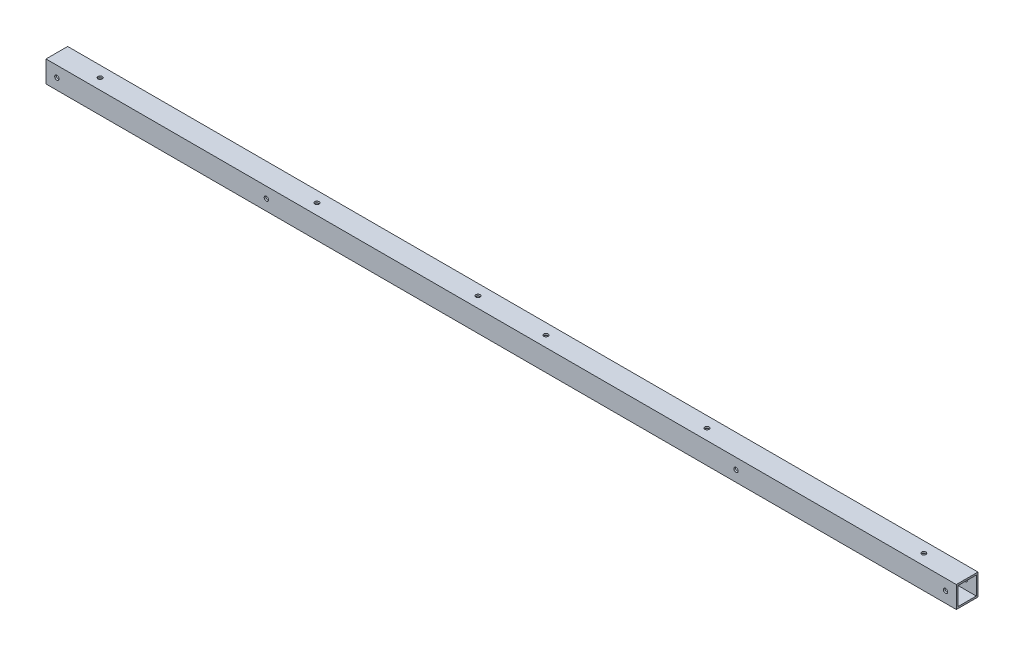
from build123d import *

# Parameters (mm, degrees)
SKETCH_1_W          = 630
SKETCH_1_H          = 15
SKETCH_1_R          = 1.5
EXTRUDE_1_DEPTH     = 15
SKETCH_3_R          = 1.5
CUT_EXTRUDE_1_DEPTH = 631.357041684
SKETCH_4_W          = 12.6
SKETCH_4_H          = 12.6
CUT_EXTRUDE_2_DEPTH = 631.357041684
SKETCH_5_R          = 1.5
CUT_EXTRUDE_3_DEPTH = 631.357041684


with BuildPart() as part:
    # ｽｹｯﾁ1 → ﾎﾞｽ - 押し出し1 (new body)
    with BuildSketch(Plane.XY):
        with Locations((315, 7.5)):
            Rectangle(SKETCH_1_W, SKETCH_1_H)
        with Locations((7.5, 7.5)):
            Circle(SKETCH_1_R, mode=Mode.SUBTRACT)
        with Locations((622.5, 7.5)):
            Circle(SKETCH_1_R, mode=Mode.SUBTRACT)
        with Locations((152.5, 7.5)):
            Circle(SKETCH_1_R, mode=Mode.SUBTRACT)
        with Locations((477.5, 7.5)):
            Circle(SKETCH_1_R, mode=Mode.SUBTRACT)
    extrude(amount=EXTRUDE_1_DEPTH)

    # ｽｹｯﾁ3 → ｶｯﾄ - 押し出し1 (cut, through all)
    with BuildSketch(Plane(origin=(0, 15, 0), x_dir=(1, 0, 0), z_dir=(0, 1, 0))):
        with Locations(Location((30, -7.5, 0), (0, 0, 270))):
            Circle(SKETCH_3_R)
        with Locations(Location((600, -7.5, 0), (0, 0, 270))):
            Circle(SKETCH_3_R)
        with Locations(Location((180, -7.5, 0), (0, 0, 270))):
            Circle(SKETCH_3_R)
        with Locations(Location((450, -7.5, 0), (0, 0, 270))):
            Circle(SKETCH_3_R)
    extrude(amount=-CUT_EXTRUDE_1_DEPTH, mode=Mode.SUBTRACT)

    # ｽｹｯﾁ4 → ｶｯﾄ - 押し出し2 (cut, through all)
    with BuildSketch(Plane(origin=(630, 0, 0), x_dir=(0, 0, -1), z_dir=(1, 0, 0))):
        with Locations((-7.5, 7.5)):
            Rectangle(SKETCH_4_W, SKETCH_4_H)
    extrude(amount=-CUT_EXTRUDE_2_DEPTH, mode=Mode.SUBTRACT)

    # ｽｹｯﾁ5 → ｶｯﾄ - 押し出し3 (cut, through all)
    with BuildSketch(Plane(origin=(0, 15, 0), x_dir=(1, 0, 0), z_dir=(0, 1, 0))):
        with Locations(Location((291.5, -7.5, 0), (0, 0, 270))):
            Circle(SKETCH_5_R)
        with Locations(Location((338.5, -7.5, 0), (0, 0, 270))):
            Circle(SKETCH_5_R)
    extrude(amount=-CUT_EXTRUDE_3_DEPTH, mode=Mode.SUBTRACT)


solid = part.part
